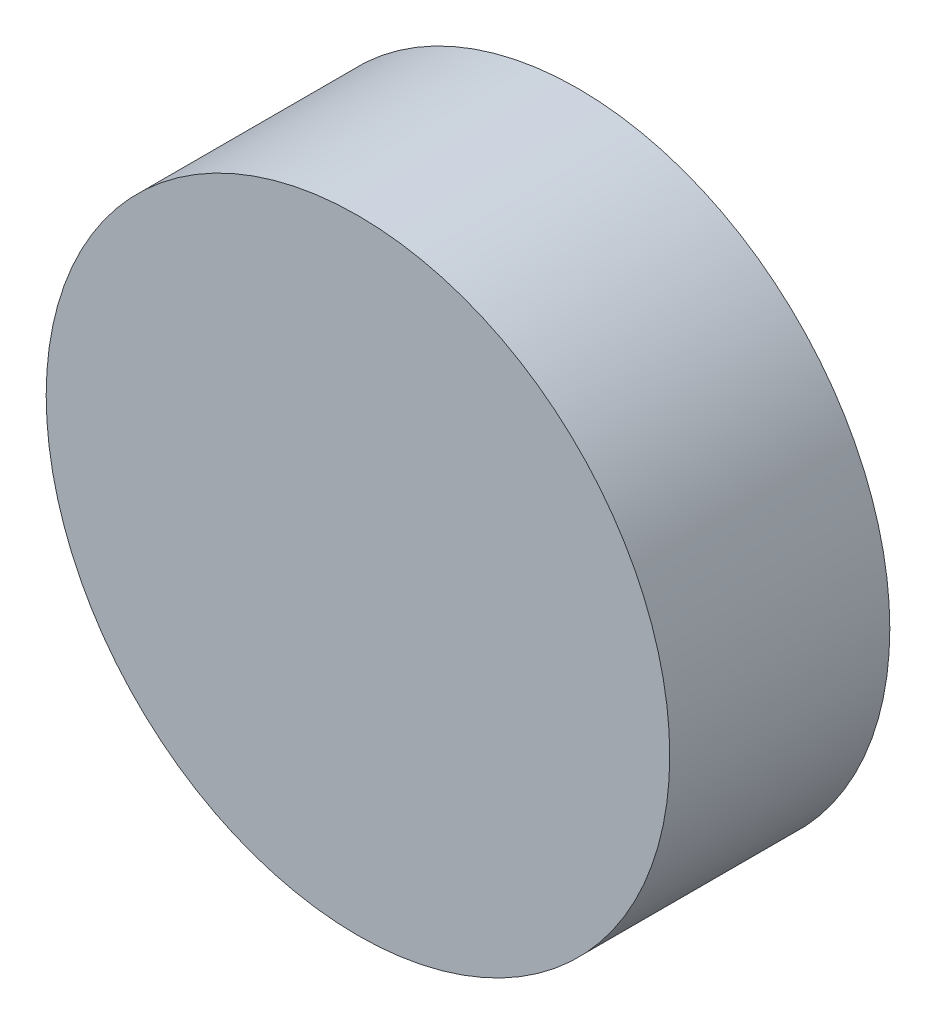
from build123d import *

# Parameters (mm, degrees)
SKETCH_1_R      = 0.0425
EXTRUDE_1_DEPTH = 0.03


with BuildPart() as part:
    # 草图1 → 凸台-拉伸1 (new body)
    with BuildSketch(Plane.XY):
        Circle(SKETCH_1_R)
    extrude(amount=EXTRUDE_1_DEPTH)


solid = part.part
